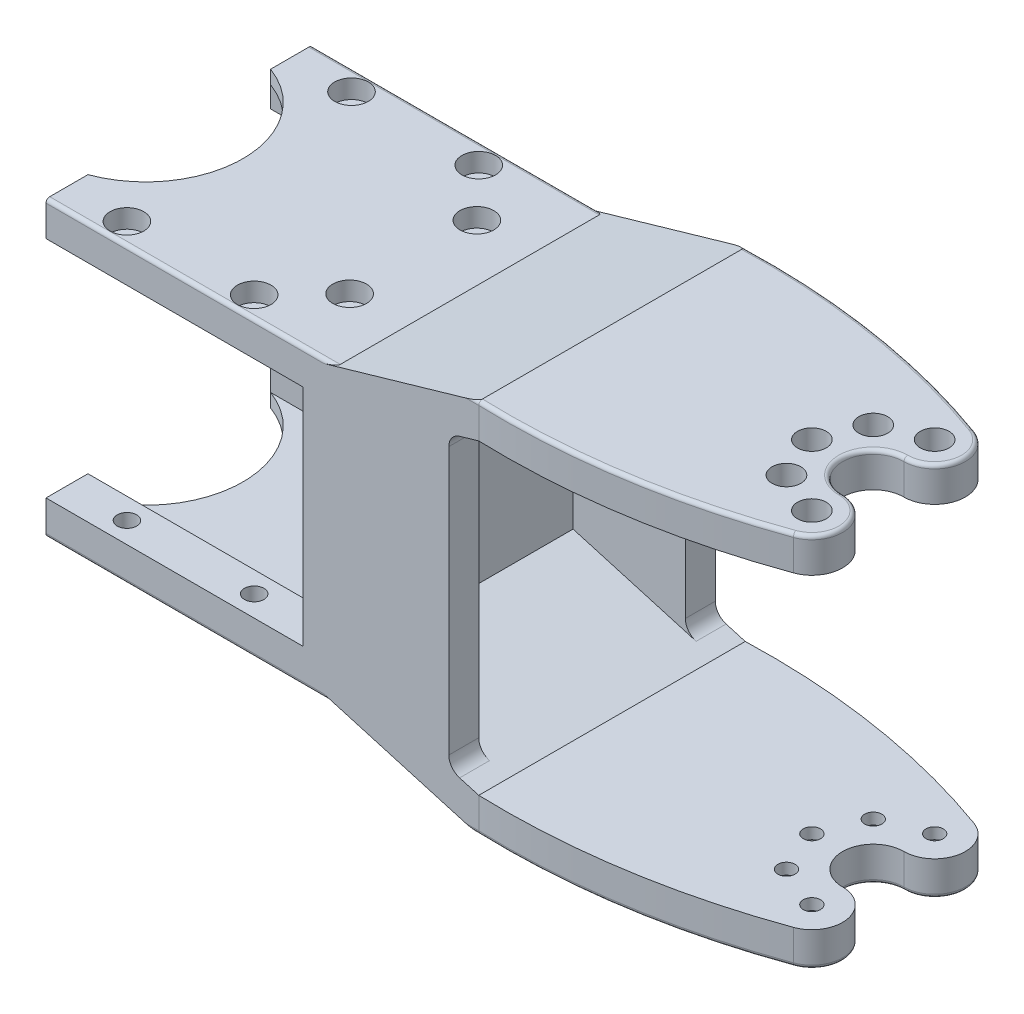
from build123d import *

# Parameters (mm, degrees)
SKETCH1_R           = 1.3
BOSS_EXTRUDE1_DEPTH = 2.8
BOSS_EXTRUDE2_START = -1.8
SKETCH2_R           = 1.3
BOSS_EXTRUDE2_DEPTH = 1.8
SKETCH3_R           = 2.25
CUT_EXTRUDE1_DEPTH  = 2.5
SKETCH4_W           = 35.6
SKETCH4_H           = 4.6
BOSS_EXTRUDE3_DEPTH = 5
SKETCH5_W           = 4.5
SKETCH5_H           = 35.6
BOSS_EXTRUDE4_DEPTH = 15
SKETCH6_R           = 1.15
BOSS_EXTRUDE5_DEPTH = 4.6
BOSS_EXTRUDE6_DEPTH = 4
FILLET2_R           = 2
SKETCH13_R          = 1.925
CUT_EXTRUDE2_DEPTH  = 3.1
FILLET10_R          = 0.5


with BuildPart() as part:
    # Sketch1 → Boss-Extrude1 (new body)
    with BuildSketch(Plane(origin=(0, 0, 0), x_dir=(1, 0, 0), z_dir=(0, 1, 0))):
        Polygon((4.489988864, 12.2), (4.489988864, 17.8), (38.3, 17.8), (38.3, -17.8), (4.489988864, -17.8), (4.489988864, -12.2), (33.2, -12.2), (33.2, 12.2), align=None)
        with Locations(Location((12.5, 15, 0), (0, 0, 270))):
            Circle(SKETCH1_R, mode=Mode.SUBTRACT)
        with Locations(Location((29.5, 15, 0), (0, 0, 270))):
            Circle(SKETCH1_R, mode=Mode.SUBTRACT)
        with Locations(Location((12.5, -15, 0), (0, 0, 270))):
            Circle(SKETCH1_R, mode=Mode.SUBTRACT)
        with Locations(Location((29.5, -15, 0), (0, 0, 270))):
            Circle(SKETCH1_R, mode=Mode.SUBTRACT)
        with Locations(Location((35.75, -8.5, 0), (0, 0, 270))):
            Circle(SKETCH1_R, mode=Mode.SUBTRACT)
        with Locations(Location((35.75, 8.5, 0), (0, 0, 270))):
            Circle(SKETCH1_R, mode=Mode.SUBTRACT)
    boss_extrude1 = extrude(amount=BOSS_EXTRUDE1_DEPTH)

    # Sketch2 → Boss-Extrude2 (add)
    # profile 1 of 2: a face of its own
    with BuildSketch(Plane(origin=(0, 0, 0), x_dir=(1, 0, 0), z_dir=(0, 1, 0)).offset(BOSS_EXTRUDE2_START)):
        with BuildLine():
            ThreePointArc((4.489988864, -12.2), (13, 0), (4.489988864, 12.2))
            Line((4.489988864, 12.2), (33.2, 12.2))
            Line((33.2, 12.2), (33.2, -12.2))
            Line((33.2, -12.2), (4.489988864, -12.2))
        make_face()
    # profile 2 of 2: a face of its own
    with BuildSketch(Plane(origin=(0, 0, 0), x_dir=(1, 0, 0), z_dir=(0, 1, 0)).offset(BOSS_EXTRUDE2_START)):
        Polygon((4.489988864, 12.2), (4.489988864, 17.8), (38.3, 17.8), (38.3, -17.8), (4.489988864, -17.8), (4.489988864, -12.2), (33.2, -12.2), (33.2, 12.2), align=None)
        with Locations(Location((12.5, -15, 0), (0, 0, 270))):
            Circle(SKETCH2_R, mode=Mode.SUBTRACT)
        with Locations(Location((29.5, -15, 0), (0, 0, 270))):
            Circle(SKETCH2_R, mode=Mode.SUBTRACT)
        with Locations(Location((35.75, -8.5, 0), (0, 0, 270))):
            Circle(SKETCH2_R, mode=Mode.SUBTRACT)
        with Locations(Location((35.75, 8.5, 0), (0, 0, 270))):
            Circle(SKETCH2_R, mode=Mode.SUBTRACT)
        with Locations(Location((29.5, 15, 0), (0, 0, 270))):
            Circle(SKETCH2_R, mode=Mode.SUBTRACT)
        with Locations(Location((12.5, 15, 0), (0, 0, 270))):
            Circle(SKETCH2_R, mode=Mode.SUBTRACT)
    boss_extrude2 = extrude(amount=BOSS_EXTRUDE2_DEPTH)

    # Sketch3 → Cut-Extrude1 (cut)
    with BuildSketch(Plane.XZ.offset(1.8)):
        with Locations(Location((12.5, 15, 0), (0, 0, 270))):
            Circle(SKETCH3_R)
        with Locations(Location((29.5, 15, 0), (0, 0, 270))):
            Circle(SKETCH3_R)
        with Locations(Location((29.5, -15, 0), (0, 0, 270))):
            Circle(SKETCH3_R)
        with Locations(Location((12.5, -15, 0), (0, 0, 270))):
            Circle(SKETCH3_R)
        with Locations(Location((35.75, 8.5, 0), (0, 0, 270))):
            Circle(SKETCH3_R)
        with Locations(Location((35.75, -8.5, 0), (0, 0, 270))):
            Circle(SKETCH3_R)
    cut_extrude1 = extrude(amount=-CUT_EXTRUDE1_DEPTH, mode=Mode.SUBTRACT)

    # Sketch4 → Boss-Extrude3 (add)
    with BuildSketch(Plane(origin=(38.3, 0, 0), x_dir=(0, 0, -1), z_dir=(1, 0, 0))):
        with Locations((0, 0.5)):
            Rectangle(SKETCH4_W, SKETCH4_H)
    boss_extrude3 = extrude(amount=BOSS_EXTRUDE3_DEPTH)

    # Sketch5 → Boss-Extrude4 (add)
    with BuildSketch(Plane(origin=(0, 2.8, 0), x_dir=(1, 0, 0), z_dir=(0, 1, 0))):
        with Locations((41.05, 0)):
            Rectangle(SKETCH5_W, SKETCH5_H)
    boss_extrude4 = extrude(amount=BOSS_EXTRUDE4_DEPTH)

    # Mirror3: Boss-Extrude1, Boss-Extrude2, Cut-Extrude1, Boss-Extrude3, Boss-Extrude4 across plane
    add(boss_extrude1.mirror(Plane.ZX.offset(17.8)))
    add(boss_extrude2.mirror(Plane.ZX.offset(17.8)))
    add(cut_extrude1.mirror(Plane.ZX.offset(17.8)), mode=Mode.SUBTRACT)
    add(boss_extrude3.mirror(Plane.ZX.offset(17.8)))
    add(boss_extrude4.mirror(Plane.ZX.offset(17.8)))



with BuildPart() as body_2:
    # Sketch6 → Boss-Extrude5 (new body)
    with BuildSketch(Plane(origin=(0, 38.3, 0), x_dir=(-1, 0, 0), z_dir=(0, -1, 0))):
        with BuildLine():
            Line((-62.3, 17.8), (-62.3, -17.8))
            ThreePointArc((-62.3, -17.8), (-80.719474162, -16.653781594), (-98.592726, -12.056204648))
            ThreePointArc((-98.592726, -12.056204648), (-101.23859128, -7.493048466), (-97.2, -4.1))
            ThreePointArc((-97.2, -4.1), (-93.1, 0), (-97.2, 4.1))
            ThreePointArc((-97.2, 4.1), (-101.23859128, 7.493048466), (-98.592726, 12.056204648))
            ThreePointArc((-98.592726, 12.056204648), (-80.719474162, 16.653781594), (-62.3, 17.8))
        make_face()
        with Locations(Location((-97.2, 8.2, 0), (0, 0, 90))):
            Circle(SKETCH6_R, mode=Mode.SUBTRACT)
        with Locations(Location((-91.401724394, 5.798275606, 0), (0, 0, 90))):
            Circle(SKETCH6_R, mode=Mode.SUBTRACT)
        with Locations(Location((-89, 0, 0), (0, 0, 90))):
            Circle(SKETCH6_R, mode=Mode.SUBTRACT)
        with Locations(Location((-91.401724394, -5.798275606, 0), (0, 0, 90))):
            Circle(SKETCH6_R, mode=Mode.SUBTRACT)
        with Locations(Location((-97.2, -8.2, 0), (0, 0, 90))):
            Circle(SKETCH6_R, mode=Mode.SUBTRACT)
    boss_extrude5 = extrude(amount=-BOSS_EXTRUDE5_DEPTH)


with BuildPart() as part_1:
    add(part.part)

    add(body_2.part)  # Loft1 merges body 2
    # Sketch7 → Loft1 section 0
    with BuildSketch(Plane(origin=(43.3, 0, 0), x_dir=(0, 0, -1), z_dir=(1, 0, 0))):
        with BuildLine():
            Line((-17.8, 37.4), (17.8, 37.4))
            Line((17.8, 37.4), (17.8, 32.8))
            Line((17.8, 32.8), (-17.8, 32.8))
            Line((-17.8, 32.8), (-17.8, 37.4))
        make_face()
    # Sketch11 → Loft1 section 1
    with BuildSketch(Plane.ZY.offset(-62.3)):
        with BuildLine():
            Line((-17.8, 38.3), (17.8, 38.3))
            Line((17.8, 38.3), (17.8, 42.9))
            Line((17.8, 42.9), (-17.8, 42.9))
            Line((-17.8, 42.9), (-17.8, 38.3))
        make_face()
    loft1 = loft()

    # Mirror4: Loft1 across plane
    add(loft1.mirror(Plane.ZX.offset(17.8)))

    # Mirror5: Boss-Extrude5 across plane
    add(boss_extrude5.mirror(Plane.ZX.offset(17.8)))

    # Sketch12 → Boss-Extrude6 (add)
    with BuildSketch(Plane.XY.offset(17.8)):
        Polygon((58.3, 37.142105263), (58.3, -1.542105263), (43.3, 2.8), (43.3, 32.8), align=None)
    boss_extrude6 = extrude(amount=-BOSS_EXTRUDE6_DEPTH)

    # Mirror6: Boss-Extrude6 across plane
    add(boss_extrude6.mirror(Plane.XY))

    # Fillet2
    fillet2_edges = [part_1.edges().sort_by_distance(p)[0] for p in [
        (58.3, -1.542105263, 15.8),
        (58.3, -1.542105263, -15.8),
        (58.3, 37.142105263, -15.8),
        (58.3, 37.142105263, 15.8),
    ]]
    fillet(fillet2_edges, radius=FILLET2_R)

    # Sketch13 → Cut-Extrude2 (cut)
    with BuildSketch(Plane(origin=(0, 42.9, 0), x_dir=(1, 0, 0), z_dir=(0, 1, 0))):
        with Locations(Location((97.2, 8.2, 0), (0, 0, 270))):
            Circle(SKETCH13_R)
        with Locations(Location((91.401724394, 5.798275606, 0), (0, 0, 270))):
            Circle(SKETCH13_R)
        with Locations(Location((89, 0, 0), (0, 0, 270))):
            Circle(SKETCH13_R)
        with Locations(Location((91.401724394, -5.798275606, 0), (0, 0, 270))):
            Circle(SKETCH13_R)
        with Locations(Location((97.2, -8.2, 0), (0, 0, 270))):
            Circle(SKETCH13_R)
    cut_extrude2 = extrude(amount=-CUT_EXTRUDE2_DEPTH, mode=Mode.SUBTRACT)

    # Mirror7: Cut-Extrude2 across plane
    add(cut_extrude2.mirror(Plane.ZX.offset(17.8)), mode=Mode.SUBTRACT)

    # Fillet10
    fillet10_edges = [part_1.edges().sort_by_distance(p)[0] for p in [
        (80.719474162, -7.3, -16.653781594),
        (101.23859128, -7.3, -7.493048466),
        (93.1, -7.3, 0),
        (101.23859128, -7.3, 7.493048466),
        (80.719474162, 42.9, -16.653781594),
        (101.23859128, 42.9, -7.493048466),
        (93.1, 42.9, 0),
        (101.23859128, 42.9, 7.493048466),
        (18.844994432, 0, 12.2),
        (23.894994432, -1.8, -17.8),
        (80.719474162, -7.3, 16.653781594),
        (23.894994432, -1.8, 17.8),
        (23.894994432, 37.4, -17.8),
        (23.894994432, 37.4, 17.8),
        (80.719474162, 42.9, 16.653781594),
    ]]
    fillet(fillet10_edges, radius=FILLET10_R)


solid = part_1.part
